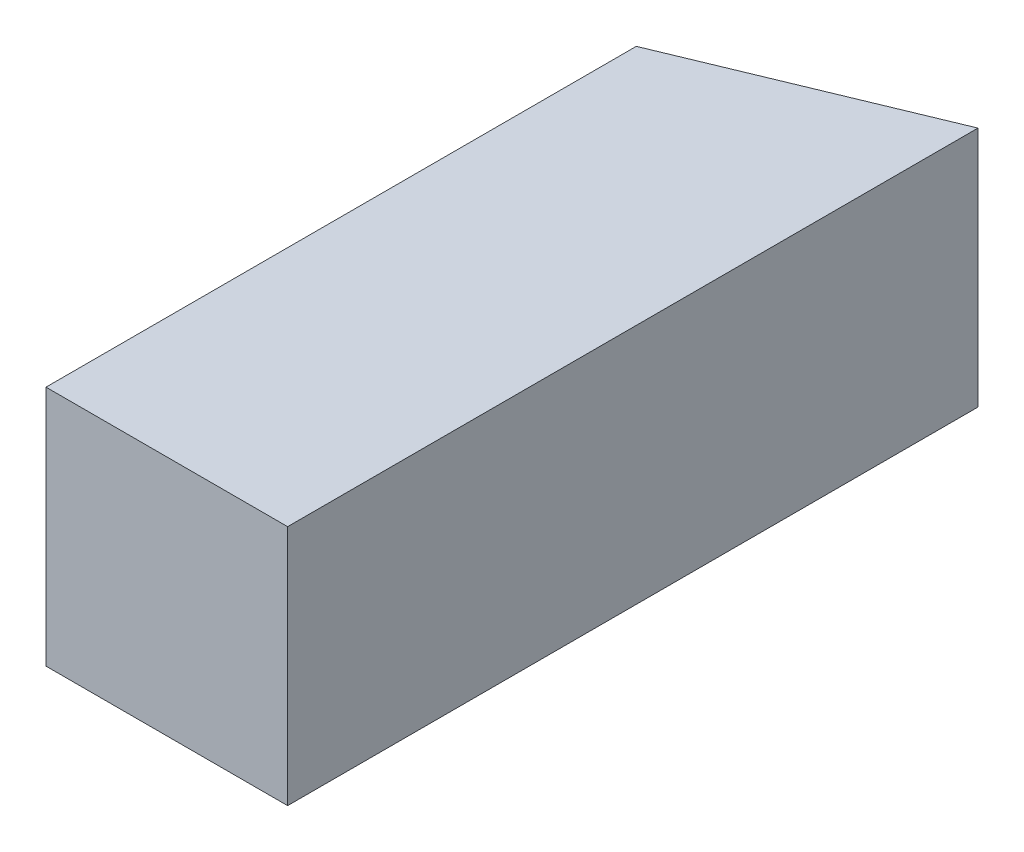
from build123d import *

# Parameters (mm, degrees)
SKETCH1_W           = 88.9
SKETCH1_H           = 88.9
BOSS_EXTRUDE1_DEPTH = 254
CUT_EXTRUDE1_REACH  = 274.754


with BuildPart() as part:
    # Sketch1 → Boss-Extrude1 (new body)
    with BuildSketch(Plane.XY):
        Rectangle(SKETCH1_W, SKETCH1_H)
    extrude(amount=BOSS_EXTRUDE1_DEPTH)

    # Sketch2 → Cut-Extrude1 (cut, up to next)
    with BuildSketch(Plane.XZ.offset(44.45), mode=Mode.PRIVATE) as cut_extrude1_sk1:
        Polygon((44.45, 0), (-44.45, 36.823585695), (-44.45, 0), align=None)
    cut_extrude1_tool1 = extrude(cut_extrude1_sk1.sketch, amount=-CUT_EXTRUDE1_REACH, mode=Mode.PRIVATE) & part.part
    add(cut_extrude1_tool1.solids().sort_by_distance((-14.816667, -44.45, 12.274529))[0], mode=Mode.SUBTRACT)


solid = part.part
